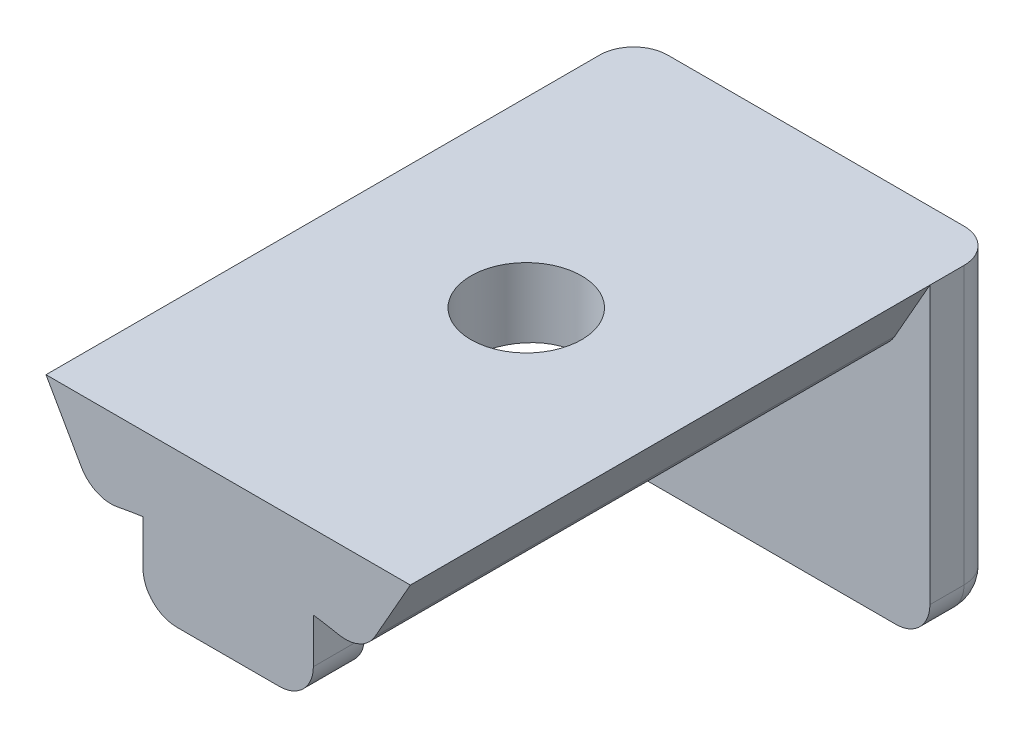
from build123d import *

# Parameters (mm, degrees)
BOSS_EXTRUDE1_DEPTH     = 30.5
BOSS_EXTRUDE2_DEPTH     = 4
CUT_EXTRUDE1_DEPTH      = 36.321701763
CUT_EXTRUDE1_DEPTH_BACK = 36.321701763
SKETCH3_R               = 3.25
BOSS_EXTRUDE3_DEPTH     = 3
FILLET2_R               = 2


with BuildPart() as part:
    # Sketch1 → Boss-Extrude1 (new body)
    with BuildSketch(Plane.XY):
        with BuildLine():
            Line((-8.621574968, 0.348529625), (-10.694763671, 4))
            Line((-10.694763671, 4), (10.694763671, 4))
            Line((10.694763671, 4), (8.621574968, 0.348529625))
            ThreePointArc((8.621574968, 0.348529625), (7.717960529, -0.481070004), (6.5, -0.627106808))
            ThreePointArc((6.5, -0.627106808), (0, 0), (-6.5, -0.627106808))
            ThreePointArc((-6.5, -0.627106808), (-7.717960529, -0.481070004), (-8.621574968, 0.348529625))
        make_face()
    extrude(amount=BOSS_EXTRUDE1_DEPTH)

    # Sketch2 → Boss-Extrude2 (add)
    with BuildSketch(Plane.XY):
        with BuildLine():
            Line((10.694763671, 4), (10.694763671, -12.24761894))
            ThreePointArc((10.694763671, -12.24761894), (10.108977233, -13.661832502), (8.694763671, -14.24761894))
            Line((8.694763671, -14.24761894), (-8.694763671, -14.24761894))
            ThreePointArc((-8.694763671, -14.24761894), (-10.108977233, -13.661832502), (-10.694763671, -12.24761894))
            Line((-10.694763671, -12.24761894), (-10.694763671, 4))
            Line((-10.694763671, 4), (10.694763671, 4))
        make_face()
    extrude(amount=-BOSS_EXTRUDE2_DEPTH)

    # Sketch3 → Cut-Extrude1 (cut, two sides: drawn at the far end of the back side and taken through both)
    with BuildSketch(Plane(origin=(0, 0, 0), x_dir=(1, 0, 0), z_dir=(0, 1, 0)).offset(-CUT_EXTRUDE1_DEPTH_BACK)):
        with Locations(Location((0, -13, 0), (0, 0, 270))):
            Circle(SKETCH3_R)
    extrude(amount=CUT_EXTRUDE1_DEPTH + CUT_EXTRUDE1_DEPTH_BACK, mode=Mode.SUBTRACT)

    # Sketch4 → Boss-Extrude3 (add)
    with BuildSketch(Plane.XY.offset(30.5)):
        with BuildLine():
            Line((-5, 4), (5, 4))
            Line((5, 4), (5, -3))
            ThreePointArc((5, -3), (4.414213562, -4.414213562), (3, -5))
            Line((3, -5), (-3, -5))
            ThreePointArc((-3, -5), (-4.414213562, -4.414213562), (-5, -3))
            Line((-5, -3), (-5, 4))
        make_face()
    extrude(amount=-BOSS_EXTRUDE3_DEPTH)

    # Fillet2
    fillet2_edges = [part.edges().sort_by_distance(p)[0] for p in [
        (-10.108977233, -13.661832502, -4),
        (-10.694763671, -4.12380947, -4),
        (10.694763671, -4.12380947, -4),
        (10.108977233, -13.661832502, -4),
        (0, -14.24761894, -4),
    ]]
    fillet(fillet2_edges, radius=FILLET2_R)


solid = part.part
